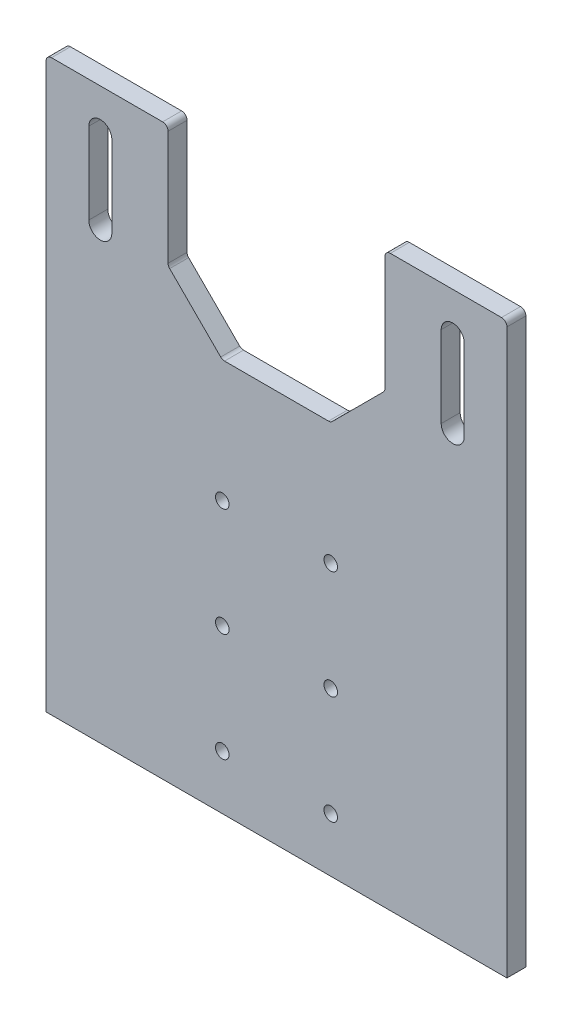
from build123d import *

# Parameters (mm, degrees)
SKETCH1_R           = 2.5
BOSS_EXTRUDE1_DEPTH = 12
CUT_EXTRUDE1_DEPTH  = 5
FILLET1_R           = 2
SKETCH4_R           = 1.5
CUT_EXTRUDE2_DEPTH  = 5


with BuildPart() as part:
    # Sketch1 → Boss-Extrude1 (new body)
    with BuildSketch(Plane.XY):
        Polygon((0, 210), (45, 210), (45, 165), (65, 145), (105, 145), (125, 165), (125, 210), (170, 210), (170, 0), (0, 0), align=None)
        with Locations((65, 20)):
            Circle(SKETCH1_R, mode=Mode.SUBTRACT)
        with Locations((65, 60)):
            Circle(SKETCH1_R, mode=Mode.SUBTRACT)
        with Locations((65, 100)):
            Circle(SKETCH1_R, mode=Mode.SUBTRACT)
        with Locations(Location((105, 100, 0), (0, 0, 180))):
            Circle(SKETCH1_R, mode=Mode.SUBTRACT)
        with Locations(Location((105, 60, 0), (0, 0, 180))):
            Circle(SKETCH1_R, mode=Mode.SUBTRACT)
        with Locations(Location((105, 20, 0), (0, 0, 180))):
            Circle(SKETCH1_R, mode=Mode.SUBTRACT)
        with BuildLine():
            Line((154.25, 195), (154.25, 165))
            ThreePointArc((154.25, 165), (150, 160.75), (145.75, 165))
            Line((145.75, 165), (145.75, 195))
            ThreePointArc((145.75, 195), (150, 199.25), (154.25, 195))
        make_face(mode=Mode.SUBTRACT)
        with BuildLine():
            Line((15.75, 195), (15.75, 165))
            ThreePointArc((15.75, 165), (20, 160.75), (24.25, 165))
            Line((24.25, 165), (24.25, 195))
            ThreePointArc((24.25, 195), (20, 199.25), (15.75, 195))
        make_face(mode=Mode.SUBTRACT)
    extrude(amount=BOSS_EXTRUDE1_DEPTH)

    # Sketch3 → Cut-Extrude1 (cut)
    with BuildSketch(Plane(origin=(0, 0, 0), x_dir=(-1, 0, 0), z_dir=(0, 0, -1))):
        Polygon((0, 0), (-55, 0), (-55, 115), (-115, 115), (-115, 0), (-170, 0), (-170, 210), (-115, 210), (-55, 210), (0, 210), align=None)
    extrude(amount=-CUT_EXTRUDE1_DEPTH, mode=Mode.SUBTRACT)

    # Fillet1
    fillet1_edges = [part.edges().sort_by_distance(p)[0] for p in [
        (0, 210, 8.5),
        (45, 210, 8.5),
        (45, 165, 8.5),
        (65, 145, 8.5),
        (105, 145, 8.5),
        (125, 165, 8.5),
        (125, 210, 8.5),
        (170, 210, 8.5),
    ]]
    fillet(fillet1_edges, radius=FILLET1_R)

    # Sketch4 → Cut-Extrude2 (cut)
    with BuildSketch(Plane.XZ):
        with Locations((85, 6)):
            Circle(SKETCH4_R)
        with Locations((105, 6)):
            Circle(SKETCH4_R)
        with Locations((155, 8.5)):
            Circle(SKETCH4_R)
        with Locations((125, 8.5)):
            Circle(SKETCH4_R)
        with Locations(Location((15, 8.5, 0), (0, 0, 180))):
            Circle(SKETCH4_R)
        with Locations(Location((45, 8.5, 0), (0, 0, 180))):
            Circle(SKETCH4_R)
        with Locations(Location((65, 6, 0), (0, 0, 180))):
            Circle(SKETCH4_R)
    extrude(amount=-CUT_EXTRUDE2_DEPTH, mode=Mode.SUBTRACT)


solid = part.part
